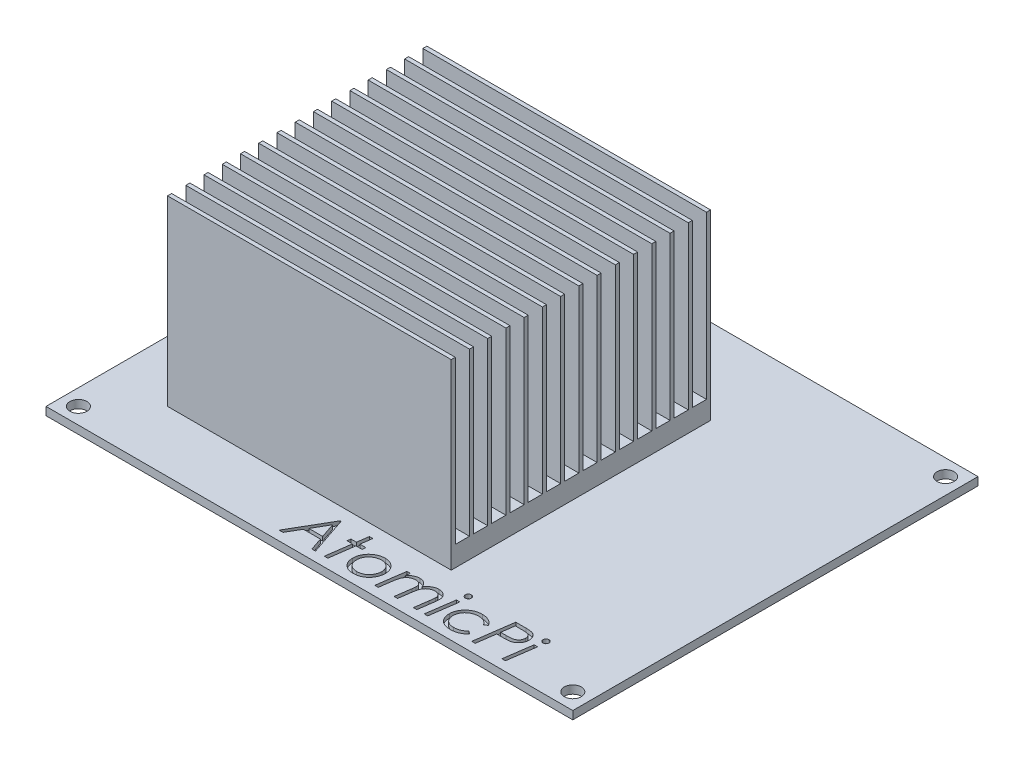
from build123d import *

# Parameters (mm, degrees)
SKETCH1_W           = 130
SKETCH1_H           = 100
SKETCH1_R           = 2.1
BOSS_EXTRUDE1_DEPTH = 2
SKETCH2_W           = 70
SKETCH2_H           = 64
BOSS_EXTRUDE2_DEPTH = 45
SKETCH3_W           = 5.891380054
SKETCH3_H           = 31.327568571
BOSS_EXTRUDE3_DEPTH = 10
CUT_EXTRUDE1_DEPTH  = 46
SKETCH5_W           = 70
SKETCH5_H           = 3.5
CUT_EXTRUDE2_DEPTH  = 40
SKETCH6_W           = 15
SKETCH6_H           = 6
BOSS_EXTRUDE4_DEPTH = 12
CUT_EXTRUDE3_DEPTH  = 1


with BuildPart() as part:
    # Sketch1 → Boss-Extrude1 (new body)
    with BuildSketch(Plane(origin=(0, 0, 0), x_dir=(1, 0, 0), z_dir=(0, 1, 0))):
        Rectangle(SKETCH1_W, SKETCH1_H)
        with Locations(Location((-61, 46, 0), (0, 0, 270))):
            Circle(SKETCH1_R, mode=Mode.SUBTRACT)
        with Locations(Location((61, 46, 0), (0, 0, 270))):
            Circle(SKETCH1_R, mode=Mode.SUBTRACT)
        with Locations(Location((-61, -46, 0), (0, 0, 270))):
            Circle(SKETCH1_R, mode=Mode.SUBTRACT)
        with Locations(Location((61, -46, 0), (0, 0, 270))):
            Circle(SKETCH1_R, mode=Mode.SUBTRACT)
    extrude(amount=BOSS_EXTRUDE1_DEPTH)

    # Sketch2 → Boss-Extrude2 (add)
    with BuildSketch(Plane(origin=(0, 2, 0), x_dir=(1, 0, 0), z_dir=(0, 1, 0))):
        with Locations((-15, -3)):
            Rectangle(SKETCH2_W, SKETCH2_H)
    extrude(amount=BOSS_EXTRUDE2_DEPTH)

    # Sketch3 → Boss-Extrude3 (add)
    with BuildSketch(Plane.XZ):
        with Locations((-62.054309973, 15.663784286)):
            Rectangle(SKETCH3_W, SKETCH3_H)
    extrude(amount=BOSS_EXTRUDE3_DEPTH)

    # Sketch4 → Cut-Extrude1 (cut)
    # profile 1 of 10: a face of its own
    with BuildSketch(Plane(origin=(0, 47, 0), x_dir=(1, 0, 0), z_dir=(0, 1, 0))):
        Polygon((-4.031924776, -38.150648634), (-0.814947613, -47.675648634), (-1.709824416, -47.675648634), (-2.78405819, -44.500648634), (-6.976050377, -44.500648634), (-8.821137517, -47.675648634), (-9.790428382, -47.675648634), (-4.251350858, -38.150648634), align=None)
        Polygon((-4.325764921, -39.938494187), (-6.479956627, -43.645840941), (-3.074082228, -43.645840941), align=None, mode=Mode.SUBTRACT)
    # profile 2 of 10: a face of its own
    with BuildSketch(Plane(origin=(0, 47, 0), x_dir=(1, 0, 0), z_dir=(0, 1, 0))):
        Polygon((2.711134118, -37.906417864), (3.571665969, -37.906417864), (3.180515127, -40.715071711), (4.649715849, -40.715071711), (4.546680993, -41.569879403), (3.062215849, -41.569879403), (2.213132315, -47.675648634), (1.352600464, -47.675648634), (2.201683998, -41.569879403), (0.864138926, -41.569879403), (0.974805993, -40.715071711), (2.319983276, -40.715071711), align=None)
    # profile 3 of 10: a face of its own
    with BuildSketch(Plane(origin=(0, 47, 0), x_dir=(1, 0, 0), z_dir=(0, 1, 0))):
        with BuildLine():
            add(Edge.make_bspline(
                [(9.324445416, -40.592956326), (9.398921038, -40.593683262), (9.546909147, -40.595127733), (9.766524754, -40.618147087), (9.982115721, -40.649353205), (10.192451173, -40.69545849), (10.397724737, -40.754724608), (10.597872525, -40.828167459), (10.795467902, -40.910718981), (10.984580491, -41.011124083), (11.168640842, -41.118742319), (11.341847963, -41.239784067), (11.506938223, -41.368911054), (11.659402395, -41.510592976), (11.80100186, -41.662170722), (11.933465638, -41.823020259), (12.05540071, -41.994442411), (12.165638813, -42.175878394), (12.265413871, -42.364696115), (12.351104575, -42.561282024), (12.423115366, -42.764356249), (12.48531702, -42.972123782), (12.530828106, -43.18729052), (12.562182428, -43.408554838), (12.585078989, -43.635826067), (12.586498606, -43.789522215), (12.587215849, -43.867175076)],
                knots=[0, 0, 0, 0, 1.03627571, 2.059150084, 3.070927706, 4.06779616, 5.054149748, 6.042845231, 7.034549244, 8.032518082, 9.021054968, 10.001029484, 10.971760647, 11.936659593, 12.895077573, 13.857576725, 14.835388912, 15.8209076, 16.811029316, 17.806244914, 18.80327064, 19.809103321, 20.823280083, 21.861332084, 22.919467504, 24, 24, 24, 24], degree=3))
            add(Edge.make_bspline(
                [(12.587215849, -43.867175076), (12.586138261, -43.956298258), (12.584001117, -44.133053271), (12.554985871, -44.395425221), (12.514020239, -44.653744052), (12.45465318, -44.907485566), (12.378480717, -45.156264167), (12.283605708, -45.398996472), (12.175997376, -45.638629248), (12.047721042, -45.869622466), (11.906784593, -46.092483544), (11.755181659, -46.304502014), (11.589432511, -46.501692009), (11.414283816, -46.687239251), (11.226786075, -46.859358885), (11.027040966, -47.018432837), (10.816426134, -47.165049168), (10.593916683, -47.296430282), (10.364029478, -47.4154976), (10.123471578, -47.516061442), (9.876790271, -47.604454138), (9.621464868, -47.67452447), (9.359801228, -47.73088949), (9.089240631, -47.767356938), (8.811712903, -47.794131671), (8.623620997, -47.796546494), (8.528787363, -47.797764018)],
                knots=[0, 0, 0, 0, 1.017087327, 2.017155118, 3.010450244, 4.002177923, 4.98990937, 5.978441356, 6.976106943, 7.986874878, 8.992202068, 9.985815693, 10.9602433, 11.931092427, 12.89734067, 13.863616201, 14.844651087, 15.824798608, 16.812129542, 17.798097515, 18.799509077, 19.80202592, 20.818957686, 21.853141412, 22.917580209, 24, 24, 24, 24], degree=3))
            add(Edge.make_bspline(
                [(8.528787363, -47.797764018), (8.412238807, -47.795678225), (8.183991345, -47.791593429), (7.850175703, -47.745433797), (7.532162184, -47.675304502), (7.228273438, -47.578658333), (6.941846736, -47.449740054), (6.670382967, -47.294419878), (6.415580977, -47.109843205), (6.178040585, -46.89927216), (5.964325269, -46.665704713), (5.774763208, -46.41628113), (5.616181188, -46.149724938), (5.485654395, -45.867758187), (5.384399373, -45.570313628), (5.311517271, -45.257902651), (5.269696438, -44.9298225), (5.263467304, -44.706199453), (5.260292772, -44.592235172)],
                knots=[0, 0, 0, 0, 1.089556378, 2.133775721, 3.145629624, 4.13340939, 5.110814317, 6.078263757, 7.054146471, 8.048729294, 9.042457604, 10.011040595, 10.974236523, 11.937854973, 12.912449201, 13.908223557, 14.933974817, 16, 16, 16, 16], degree=3))
            add(Edge.make_bspline(
                [(5.260292772, -44.592235172), (5.261369381, -44.501841108), (5.263504766, -44.322550299), (5.292539726, -44.056367418), (5.333326374, -43.794854283), (5.392641003, -43.538494332), (5.469813343, -43.288467989), (5.560379468, -43.042659855), (5.673023924, -42.804347094), (5.797342896, -42.570158644), (5.938728143, -42.345403603), (6.093103674, -42.132015431), (6.259283229, -41.930447996), (6.439821038, -41.743065353), (6.632098676, -41.567491431), (6.837440594, -41.405313123), (7.053113836, -41.253395192), (7.282151783, -41.117096145), (7.518885756, -40.993581774), (7.762133195, -40.885817652), (8.01062855, -40.796971856), (8.263127717, -40.72127856), (8.521619286, -40.664769594), (8.784613399, -40.622487455), (9.052988935, -40.596858853), (9.23343962, -40.594264648), (9.324445416, -40.592956326)],
                knots=[0, 0, 0, 0, 1.024713341, 2.032452976, 3.033353726, 4.025482262, 5.013511511, 5.999616649, 6.993631463, 8.000544617, 9.005259126, 10.002305436, 10.98592741, 11.965467619, 12.950965753, 13.936701455, 14.931265759, 15.94073365, 16.957033976, 17.958246597, 18.955397277, 19.948259791, 20.945827841, 21.953851424, 22.96807607, 24, 24, 24, 24], degree=3))
        make_face()
        with BuildLine():
            add(Edge.make_bspline(
                [(9.299640728, -41.447764018), (9.158097314, -41.452299801), (8.877359796, -41.461296081), (8.463665935, -41.540622307), (8.063593607, -41.669688073), (7.744408786, -41.817315533), (7.499543632, -41.956503188), (7.327193668, -42.072529322), (7.164615885, -42.197381069), (7.015042244, -42.333518769), (6.872635943, -42.475514645), (6.74418785, -42.63020699), (6.626477531, -42.793569289), (6.484035303, -43.022429751), (6.335997785, -43.325452534), (6.207272018, -43.710088262), (6.128473486, -44.113918106), (6.119596461, -44.389628733), (6.115100464, -44.529269427)],
                knots=[0, 0, 0, 0, 1.372743697, 2.722702845, 4.071645436, 5.444389132, 6.127359067, 6.803628796, 7.459271053, 8.114942369, 8.765332867, 9.409483052, 10.063932782, 10.718266051, 12.024090525, 13.326115932, 14.645743067, 16, 16, 16, 16], degree=3))
            add(Edge.make_bspline(
                [(6.115100464, -44.529269427), (6.117403634, -44.616497867), (6.121925444, -44.787753363), (6.154356274, -45.038411358), (6.209838994, -45.276061701), (6.286663989, -45.501022875), (6.3842089, -45.714420149), (6.504740421, -45.915687833), (6.648978224, -46.103065322), (6.812633481, -46.276355408), (6.994025948, -46.432342335), (7.188193295, -46.570288668), (7.396730429, -46.686323149), (7.61882725, -46.778471136), (7.851906887, -46.854535771), (8.099091406, -46.904471863), (8.358000128, -46.938812203), (8.535665036, -46.941558458), (8.62609806, -46.942956326)],
                knots=[0, 0, 0, 0, 1.069610863, 2.09996579, 3.093251973, 4.057699662, 5.010501648, 5.965599547, 6.928152941, 7.9047617, 8.883610534, 9.857443192, 10.821102044, 11.803301409, 12.802328473, 13.822685622, 14.891727543, 16, 16, 16, 16], degree=3))
            add(Edge.make_bspline(
                [(8.62609806, -46.942956326), (8.767600601, -46.938199441), (9.045524241, -46.928856494), (9.451812023, -46.854848046), (9.836774529, -46.731344738), (10.200495702, -46.562358783), (10.534956193, -46.344275572), (10.8361542, -46.081646127), (11.101028352, -45.7761906), (11.324461829, -45.431157514), (11.504885606, -45.058636639), (11.638299877, -44.668273096), (11.716287508, -44.262690221), (11.727004159, -43.988344602), (11.732408156, -43.8500026)],
                knots=[0, 0, 0, 0, 1.041031538, 2.044679016, 3.027709902, 4.009904446, 4.987626416, 5.956465705, 6.942045831, 7.953523378, 8.973157787, 9.981293248, 10.982043401, 12, 12, 12, 12], degree=3))
            add(Edge.make_bspline(
                [(11.732408156, -43.8500026), (11.729141413, -43.735234971), (11.722761188, -43.511084143), (11.661166993, -43.185430704), (11.564462084, -42.879698152), (11.4282844, -42.595800838), (11.256521809, -42.33718517), (11.050215292, -42.108481694), (10.812775626, -41.908590233), (10.543497311, -41.745682836), (10.255087132, -41.610574779), (9.947749201, -41.517980859), (9.628238652, -41.458297464), (9.409940481, -41.451299757), (9.299640728, -41.447764018)],
                knots=[0, 0, 0, 0, 1.077193536, 2.103849527, 3.101581798, 4.082405951, 5.051880133, 6.008097985, 6.966702469, 7.956675201, 8.956587919, 9.95073534, 10.96456583, 12, 12, 12, 12], degree=3))
        make_face(mode=Mode.SUBTRACT)
    # profile 4 of 10: a face of its own
    with BuildSketch(Plane(origin=(0, 47, 0), x_dir=(1, 0, 0), z_dir=(0, 1, 0))):
        with BuildLine():
            Line((14.796741089, -40.715071711), (15.65727294, -40.715071711))
            Line((15.65727294, -40.715071711), (15.500812603, -41.812202119))
            add(Edge.make_bspline(
                [(15.500812603, -41.812202119), (15.57170186, -41.720540523), (15.712855577, -41.538025209), (15.964525876, -41.299874224), (16.241137355, -41.088678977), (16.544773388, -40.915046186), (16.860318354, -40.77101141), (17.182818476, -40.670169643), (17.506144128, -40.605514418), (17.722764246, -40.597128701), (17.830545176, -40.592956326)],
                knots=[0, 0, 0, 0, 1.019636175, 2.030285597, 3.042363369, 4.07945189, 5.105351849, 6.092548697, 7.050933606, 8, 8, 8, 8], degree=3))
            add(Edge.make_bspline(
                [(17.830545176, -40.592956326), (17.896736466, -40.594579065), (18.026909819, -40.597770381), (18.219909172, -40.618435086), (18.406031065, -40.657026877), (18.586847312, -40.709477814), (18.763135823, -40.772557713), (18.931137009, -40.857326506), (19.096305108, -40.950675756), (19.198695424, -41.026267797), (19.250136522, -41.064245388)],
                knots=[0, 0, 0, 0, 1.042797149, 2.050789467, 3.052938591, 4.032852668, 5.015580024, 5.996927324, 6.993652328, 8, 8, 8, 8], degree=3))
            add(Edge.make_bspline(
                [(19.250136522, -41.064245388), (19.327144088, -41.130412845), (19.484152144, -41.265319377), (19.67703744, -41.522722844), (19.840560357, -41.822454261), (19.91913611, -42.044291244), (19.959932195, -42.159467744)],
                knots=[0, 0, 0, 0, 0.917554046, 1.870769106, 2.894515426, 4, 4, 4, 4], degree=3))
            add(Edge.make_bspline(
                [(19.959932195, -42.159467744), (20.041629476, -42.039563431), (20.202511541, -41.803442313), (20.489884778, -41.493157985), (20.801148289, -41.221121209), (21.140233586, -40.998497655), (21.492651342, -40.818581681), (21.852996172, -40.68997675), (22.215881187, -40.606526129), (22.460318212, -40.597456345), (22.581596858, -40.592956326)],
                knots=[0, 0, 0, 0, 1.093285388, 2.152948156, 3.180331568, 4.205067139, 5.205058416, 6.158203104, 7.086183305, 8, 8, 8, 8], degree=3))
            add(Edge.make_bspline(
                [(22.581596858, -40.592956326), (22.661837615, -40.594644129), (22.819032289, -40.5979506), (23.048621517, -40.628100398), (23.268333775, -40.67242199), (23.476064948, -40.740337107), (23.674110558, -40.823876428), (23.860240061, -40.92757162), (24.034913454, -41.050985982), (24.198130821, -41.191269468), (24.34609359, -41.346391703), (24.475163508, -41.514010736), (24.584987014, -41.691958897), (24.672733675, -41.882578295), (24.741803231, -42.083978039), (24.790877946, -42.296885665), (24.822643316, -42.520405354), (24.825780368, -42.673259839), (24.827375103, -42.750964138)],
                knots=[0, 0, 0, 0, 1.101204936, 2.15730208, 3.174669571, 4.17441865, 5.152536678, 6.122040208, 7.093586785, 8.084370698, 9.072688436, 10.031633152, 10.984194408, 11.937515935, 12.90686213, 13.902445171, 14.933698088, 16, 16, 16, 16], degree=3))
            add(Edge.make_bspline(
                [(24.827375103, -42.750964138), (24.826129638, -42.827312375), (24.823480352, -42.989716149), (24.805053559, -43.246174422), (24.776334577, -43.52995099), (24.749745183, -43.727322772), (24.735788565, -43.830922071)],
                knots=[0, 0, 0, 0, 0.84467635, 1.796749117, 2.843526446, 4, 4, 4, 4], degree=3))
            Line((24.735788565, -43.830922071), (24.193901546, -47.675648634))
            Line((24.193901546, -47.675648634), (23.333369695, -47.675648634))
            Line((23.333369695, -47.675648634), (23.80656681, -44.313659451))
            add(Edge.make_bspline(
                [(23.80656681, -44.313659451), (23.818144325, -44.229086132), (23.840507075, -44.065727072), (23.870690851, -43.829716835), (23.898187978, -43.611720978), (23.91924095, -43.411976044), (23.934286159, -43.230605669), (23.945635954, -43.068414474), (23.954534904, -42.924694942), (23.955120852, -42.834929836), (23.955394935, -42.792941302)],
                knots=[0, 0, 0, 0, 1.339891782, 2.588091189, 3.734744212, 4.788733551, 5.740509554, 6.591206585, 7.341022663, 8, 8, 8, 8], degree=3))
            add(Edge.make_bspline(
                [(23.955394935, -42.792941302), (23.954504628, -42.745169888), (23.952763859, -42.651765007), (23.932944436, -42.514937846), (23.900802262, -42.384326882), (23.854162443, -42.26012094), (23.797628103, -42.140974243), (23.725756221, -42.029424315), (23.641843694, -41.924728118), (23.545944337, -41.826903701), (23.440010618, -41.738874931), (23.326736079, -41.65796207), (23.202279104, -41.595009782), (23.071241952, -41.540108882), (22.932234518, -41.49921895), (22.785091517, -41.467452199), (22.629671357, -41.451168329), (22.523114427, -41.448910291), (22.469021738, -41.447764018)],
                knots=[0, 0, 0, 0, 1.018645287, 1.991702465, 2.942937727, 3.883267986, 4.81799953, 5.751646756, 6.707517506, 7.676781814, 8.668957119, 9.643999648, 10.639510629, 11.63751605, 12.672216696, 13.726227895, 14.845739561, 16, 16, 16, 16], degree=3))
            add(Edge.make_bspline(
                [(22.469021738, -41.447764018), (22.35288856, -41.453215087), (22.121926088, -41.464056022), (21.781566966, -41.541925764), (21.456382985, -41.677026494), (21.149147604, -41.856736494), (20.870699494, -42.071528171), (20.629623541, -42.308326723), (20.432887363, -42.565677295), (20.280074781, -42.847502908), (20.159339583, -43.159554391), (20.058306082, -43.507339959), (19.970072905, -43.896013764), (19.927081573, -44.170245942), (19.904598661, -44.313659451)],
                knots=[0, 0, 0, 0, 0.984220582, 1.957390834, 2.941640954, 3.958892467, 4.966178147, 5.915531302, 6.815990842, 7.701589139, 8.623741923, 9.647346779, 10.769647475, 12, 12, 12, 12], degree=3))
            Line((19.904598661, -44.313659451), (19.431401546, -47.675648634))
            Line((19.431401546, -47.675648634), (18.570869695, -47.675648634))
            Line((18.570869695, -47.675648634), (19.112756714, -43.830922071))
            add(Edge.make_bspline(
                [(19.112756714, -43.830922071), (19.126027443, -43.733679449), (19.151056676, -43.550275184), (19.17819454, -43.289419714), (19.194167123, -43.058995426), (19.197207753, -42.915076404), (19.198619094, -42.848274836)],
                knots=[0, 0, 0, 0, 1.19306778, 2.250183244, 3.187803657, 4, 4, 4, 4], degree=3))
            add(Edge.make_bspline(
                [(19.198619094, -42.848274836), (19.197661083, -42.79670512), (19.19577363, -42.695103528), (19.176744701, -42.546709277), (19.143598839, -42.406477308), (19.10073387, -42.274075959), (19.042047035, -42.150371648), (18.971990152, -42.034437302), (18.888953213, -41.92612909), (18.79356797, -41.827710779), (18.688885216, -41.738146667), (18.576248909, -41.659249982), (18.454377726, -41.593846033), (18.32493111, -41.541106498), (18.187787206, -41.498438527), (18.043468178, -41.468142376), (17.890754118, -41.450885436), (17.786704256, -41.448823578), (17.733234478, -41.447764018)],
                knots=[0, 0, 0, 0, 1.083420073, 2.134531926, 3.136387365, 4.108556949, 5.053325455, 6.006940478, 6.950668334, 7.914903213, 8.881913406, 9.84224937, 10.799137413, 11.782089919, 12.77561843, 13.813731979, 14.876507245, 16, 16, 16, 16], degree=3))
            add(Edge.make_bspline(
                [(17.733234478, -41.447764018), (17.642731206, -41.450707868), (17.461841063, -41.456591781), (17.194133937, -41.503923789), (16.931820818, -41.58095936), (16.679414463, -41.687733293), (16.439196323, -41.815659406), (16.221495227, -41.967592338), (16.023993124, -42.135975165), (15.851314298, -42.327101578), (15.699579196, -42.538300791), (15.568917738, -42.77297914), (15.456535608, -43.029676706), (15.368556219, -43.305927831), (15.294693349, -43.586343629), (15.229126811, -43.859681485), (15.177542948, -44.122781129), (15.149901405, -44.294499619), (15.136374502, -44.378533249)],
                knots=[0, 0, 0, 0, 1.001330282, 2.00137268, 2.99943047, 4.021922094, 5.029962193, 6.006456129, 6.954907924, 7.896883244, 8.850364991, 9.827569325, 10.86483684, 11.946870634, 13.033042326, 14.074744565, 15.057840524, 16, 16, 16, 16], degree=3))
            Line((15.136374502, -44.378533249), (14.668901546, -47.675648634))
            Line((14.668901546, -47.675648634), (13.808369695, -47.675648634))
            Line((13.808369695, -47.675648634), (14.796741089, -40.715071711))
        make_face()
    # profile 5 of 10: a face of its own
    with BuildSketch(Plane(origin=(0, 47, 0), x_dir=(1, 0, 0), z_dir=(0, 1, 0))):
        with BuildLine():
            add(Edge.make_bspline(
                [(27.729523541, -37.78430248), (27.778123638, -37.786814776), (27.873871236, -37.791764278), (28.012362285, -37.832908869), (28.137729079, -37.903761099), (28.249837603, -37.996680726), (28.342757229, -38.108789249), (28.41360946, -38.234156043), (28.45475405, -38.372647092), (28.459703553, -38.468394691), (28.462215849, -38.516994787)],
                knots=[0, 0, 0, 0, 1.013030613, 1.995783029, 2.982024995, 4, 5.017975005, 6.004216971, 6.986969387, 8, 8, 8, 8], degree=3))
            add(Edge.make_bspline(
                [(28.462215849, -38.516994787), (28.459681467, -38.56621837), (28.454688669, -38.663190099), (28.414039848, -38.803131946), (28.342762693, -38.929087492), (28.249677188, -39.040811718), (28.138818829, -39.13481387), (28.011218597, -39.200217821), (27.874016639, -39.242494798), (27.778172593, -39.247265537), (27.729523541, -39.249687095)],
                knots=[0, 0, 0, 0, 1.024536501, 2.018363392, 3.002960043, 4.019236793, 5.035513544, 6.007546471, 6.988659393, 8, 8, 8, 8], degree=3))
            add(Edge.make_bspline(
                [(27.729523541, -39.249687095), (27.68025007, -39.247245151), (27.583180058, -39.242434457), (27.444538679, -39.20063094), (27.316343309, -39.134817013), (27.20586645, -39.040651879), (27.111701315, -38.930175019), (27.045887388, -38.80197965), (27.004083871, -38.663338271), (26.999273178, -38.566268259), (26.996831233, -38.516994787)],
                knots=[0, 0, 0, 0, 1.022830147, 2.01500183, 2.985415847, 4, 5.014584153, 5.98499817, 6.977169853, 8, 8, 8, 8], degree=3))
            add(Edge.make_bspline(
                [(26.996831233, -38.516994787), (26.999252791, -38.468345735), (27.00402353, -38.37250169), (27.046300507, -38.235299731), (27.111704458, -38.107699499), (27.205706611, -37.99684114), (27.317430836, -37.903755635), (27.443386382, -37.83247848), (27.58332823, -37.791829659), (27.680299959, -37.786836862), (27.729523541, -37.78430248)],
                knots=[0, 0, 0, 0, 1.011340607, 1.992453529, 2.964486456, 3.980763207, 4.997039957, 5.981636608, 6.975463499, 8, 8, 8, 8], degree=3))
        make_face()
    # profile 6 of 10: a face of its own
    with BuildSketch(Plane(origin=(0, 47, 0), x_dir=(1, 0, 0), z_dir=(0, 1, 0))):
        Polygon((27.008279551, -40.715071711), (27.868811401, -40.715071711), (26.880440007, -47.675648634), (26.019908156, -47.675648634), align=None)
    # profile 7 of 10: a face of its own
    with BuildSketch(Plane(origin=(0, 47, 0), x_dir=(1, 0, 0), z_dir=(0, 1, 0))):
        with BuildLine():
            Line((36.399715849, -42.237697912), (35.659391329, -42.668917864))
            add(Edge.make_bspline(
                [(35.659391329, -42.668917864), (35.592602078, -42.571539175), (35.461348566, -42.380171631), (35.223248578, -42.130466066), (34.960388805, -41.919433764), (34.67235348, -41.744512934), (34.357078667, -41.611362589), (34.016053271, -41.51604397), (33.649652792, -41.457955838), (33.396658945, -41.451222839), (33.266693012, -41.447764018)],
                knots=[0, 0, 0, 0, 1.006368034, 1.977703555, 2.931287349, 3.876057278, 4.843853284, 5.842109818, 6.891466274, 8, 8, 8, 8], degree=3))
            add(Edge.make_bspline(
                [(33.266693012, -41.447764018), (33.114390859, -41.452431135), (32.814276381, -41.461627782), (32.374306747, -41.537472679), (31.95590815, -41.664648479), (31.624838203, -41.809032314), (31.375963299, -41.948616125), (31.199662998, -42.063732235), (31.033282324, -42.187956964), (30.876702368, -42.321338276), (30.730441816, -42.464729804), (30.597964706, -42.620153439), (30.472362403, -42.782919174), (30.32191596, -43.011760135), (30.16508631, -43.31266845), (30.028245449, -43.690352118), (29.942264401, -44.080829882), (29.932503769, -44.346299828), (29.927600464, -44.479660052)],
                knots=[0, 0, 0, 0, 1.454102064, 2.865337582, 4.249080667, 5.622785341, 6.305501153, 6.972770453, 7.632530544, 8.287518448, 8.936193138, 9.586572476, 10.23663963, 10.898828654, 12.200395727, 13.46683786, 14.727452674, 16, 16, 16, 16], degree=3))
            add(Edge.make_bspline(
                [(29.927600464, -44.479660052), (29.930711162, -44.596359249), (29.936808004, -44.825084931), (30.00120918, -45.158112246), (30.099360317, -45.473628764), (30.238936394, -45.767695541), (30.414478413, -46.035805985), (30.62380035, -46.272647996), (30.866590241, -46.475825631), (31.140010888, -46.645736814), (31.443279962, -46.779470617), (31.773052713, -46.874673352), (32.128703949, -46.93290173), (32.374766833, -46.939537099), (32.501563805, -46.942956326)],
                knots=[0, 0, 0, 0, 1.045843838, 2.049811393, 3.031591347, 4.004123559, 4.960090976, 5.89793496, 6.829507999, 7.790673054, 8.776821496, 9.793488215, 10.862977582, 12, 12, 12, 12], degree=3))
            add(Edge.make_bspline(
                [(32.501563805, -46.942956326), (32.634056835, -46.939318343), (32.897111573, -46.932095408), (33.287307668, -46.87309627), (33.667294349, -46.775433374), (34.033023683, -46.642314938), (34.374860694, -46.481977806), (34.680767642, -46.293174909), (34.950087313, -46.085582304), (35.098596923, -45.92307058), (35.170929791, -45.843917864)],
                knots=[0, 0, 0, 0, 1.070010768, 2.124424235, 3.180001424, 4.234915574, 5.26459992, 6.22431616, 7.135138096, 8, 8, 8, 8], degree=3))
            Line((35.170929791, -45.843917864), (35.91125431, -46.364816302))
            add(Edge.make_bspline(
                [(35.91125431, -46.364816302), (35.796427287, -46.482880964), (35.572183459, -46.713447524), (35.205319094, -47.013719487), (34.821419982, -47.260438136), (34.422201258, -47.463123922), (33.997741699, -47.615259236), (33.544393403, -47.720490527), (33.059423793, -47.787197279), (32.725033054, -47.794175598), (32.553081233, -47.797764018)],
                knots=[0, 0, 0, 0, 1.047829676, 2.046289557, 3.009860242, 3.947775691, 4.890372095, 5.872402488, 6.905937807, 8, 8, 8, 8], degree=3))
            add(Edge.make_bspline(
                [(32.553081233, -47.797764018), (32.420023388, -47.795557892), (32.160838462, -47.791260554), (31.783279164, -47.747507446), (31.427738465, -47.681013695), (31.095234416, -47.582465804), (30.784815836, -47.459002356), (30.496126712, -47.307201094), (30.229416047, -47.128080759), (29.989187893, -46.918650787), (29.773801042, -46.688347257), (29.585175563, -46.438641477), (29.425422971, -46.170308094), (29.297968556, -45.881333685), (29.196538742, -45.575382787), (29.123707641, -45.250828283), (29.082180205, -44.908145596), (29.075965891, -44.673756557), (29.072792772, -44.554074114)],
                knots=[0, 0, 0, 0, 1.185921745, 2.310070768, 3.3844686, 4.407310063, 5.39721934, 6.358648368, 7.310259435, 8.255087002, 9.193990185, 10.117245901, 11.04024032, 11.971905126, 12.927765079, 13.910107976, 14.932870829, 16, 16, 16, 16], degree=3))
            add(Edge.make_bspline(
                [(29.072792772, -44.554074114), (29.076304303, -44.419661456), (29.083210646, -44.155303857), (29.142538236, -43.766519682), (29.237957641, -43.392458207), (29.371294749, -43.03243588), (29.545682904, -42.688986733), (29.753852175, -42.358352967), (30.004121492, -42.045007682), (30.288719531, -41.749709811), (30.599690755, -41.479267589), (30.932719611, -41.242277753), (31.282381617, -41.041941546), (31.649053916, -40.875325921), (32.03438468, -40.751113366), (32.435527865, -40.657760182), (32.854404556, -40.604697849), (33.139347042, -40.596907481), (33.283865488, -40.592956326)],
                knots=[0, 0, 0, 0, 1.002277488, 1.971240463, 2.926408626, 3.878259464, 4.828891444, 5.795073931, 6.788042611, 7.81489549, 8.85089398, 9.85806746, 10.85914251, 11.853029005, 12.856832748, 13.874314015, 14.921884765, 16, 16, 16, 16], degree=3))
            add(Edge.make_bspline(
                [(33.283865488, -40.592956326), (33.371025252, -40.594743272), (33.543002662, -40.598269147), (33.797371354, -40.616595259), (34.043825738, -40.651470102), (34.282803328, -40.698970441), (34.513584551, -40.759823241), (34.736934442, -40.834456936), (34.951157967, -40.924404558), (35.158383458, -41.024993332), (35.353893858, -41.139895221), (35.540141031, -41.26369364), (35.713428093, -41.399124544), (35.875686464, -41.545524762), (36.02481464, -41.703060869), (36.163918581, -41.86968889), (36.288370323, -42.048578483), (36.362353334, -42.174238), (36.399715849, -42.237697912)],
                knots=[0, 0, 0, 0, 1.130497713, 2.230617195, 3.3049554, 4.356410595, 5.388766123, 6.39819681, 7.407661195, 8.399962059, 9.383171059, 10.346280706, 11.298306692, 12.232660293, 13.177800963, 14.109273957, 15.04515541, 16, 16, 16, 16], degree=3))
        make_face()
    # profile 8 of 10: a face of its own
    with BuildSketch(Plane(origin=(0, 47, 0), x_dir=(1, 0, 0), z_dir=(0, 1, 0))):
        with BuildLine():
            Line((39.078622099, -38.150648634), (41.595343853, -38.150648634))
            add(Edge.make_bspline(
                [(41.595343853, -38.150648634), (41.695848511, -38.151275749), (41.889295506, -38.152482793), (42.167943563, -38.164555673), (42.425062884, -38.181200666), (42.660281167, -38.204405823), (42.873314055, -38.239684742), (43.06379017, -38.279181625), (43.23368128, -38.323495417), (43.427462285, -38.397322163), (43.645829944, -38.510517926), (43.880659545, -38.68045552), (44.084759571, -38.889344113), (44.262988417, -39.127368876), (44.40600172, -39.396106143), (44.507549858, -39.690968057), (44.569843134, -40.008391735), (44.577510223, -40.228226839), (44.581446618, -40.341093345)],
                knots=[0, 0, 0, 0, 1.135332684, 2.185238988, 3.150208107, 4.046040219, 4.854001743, 5.588181339, 6.243560949, 6.834748932, 7.927376448, 9.012417828, 10.094600696, 11.214043572, 12.361542901, 13.518161337, 14.725788303, 16, 16, 16, 16], degree=3))
            add(Edge.make_bspline(
                [(44.581446618, -40.341093345), (44.580187612, -40.416215153), (44.577715693, -40.563708567), (44.551994489, -40.781345716), (44.510034984, -40.991144415), (44.452589608, -41.194007703), (44.380254418, -41.390680342), (44.288509501, -41.578633844), (44.180256523, -41.759155676), (44.059487024, -41.932224633), (43.923919608, -42.092909401), (43.780717488, -42.243004618), (43.627526676, -42.378897683), (43.465143939, -42.500935887), (43.294807367, -42.609908684), (43.1168775, -42.706434573), (42.928512145, -42.786517501), (42.798366858, -42.830065634), (42.732543373, -42.852090941)],
                knots=[0, 0, 0, 0, 1.077613652, 2.115775993, 3.139637116, 4.14510796, 5.138576732, 6.142762576, 7.14141659, 8.156821813, 9.16766358, 10.155287502, 11.131543445, 12.102666116, 13.067290607, 14.031007908, 15.004144336, 16, 16, 16, 16], degree=3))
            add(Edge.make_bspline(
                [(42.732543373, -42.852090941), (42.679256616, -42.866635315), (42.564590768, -42.897932827), (42.377402367, -42.935869788), (42.162422733, -42.964587184), (41.920218689, -42.992566536), (41.648886094, -43.009400768), (41.350026353, -43.02610051), (41.023583203, -43.032086544), (40.797140295, -43.034177525), (40.679478469, -43.035264018)],
                knots=[0, 0, 0, 0, 0.641206386, 1.379788876, 2.215232503, 3.158725674, 4.209900022, 5.370746801, 6.633815758, 8, 8, 8, 8], degree=3))
            Line((40.679478469, -43.035264018), (39.254162964, -43.035264018))
            Line((39.254162964, -43.035264018), (38.60351693, -47.675648634))
            Line((38.60351693, -47.675648634), (37.742985079, -47.675648634))
            Line((37.742985079, -47.675648634), (39.078622099, -38.150648634))
        make_face()
        with BuildLine():
            Line((39.818946618, -39.005456326), (39.374370296, -42.180456326))
            Line((39.374370296, -42.180456326), (40.710007315, -42.180456326))
            add(Edge.make_bspline(
                [(40.710007315, -42.180456326), (40.81812918, -42.179376465), (41.025494499, -42.177305414), (41.323963272, -42.171272562), (41.596124667, -42.154700883), (41.842629521, -42.137502811), (42.062859892, -42.110625351), (42.256862299, -42.078112457), (42.426498294, -42.04366588), (42.614819449, -41.985548668), (42.824037049, -41.893844526), (43.047596545, -41.748860805), (43.24650472, -41.571760207), (43.41550832, -41.362791252), (43.55431993, -41.132629146), (43.654919565, -40.884943232), (43.716388295, -40.624578761), (43.723199006, -40.446367707), (43.726638926, -40.356357768)],
                knots=[0, 0, 0, 0, 1.292499712, 2.478866002, 3.567711026, 4.55136461, 5.4320969, 6.218239379, 6.902667729, 7.499057556, 8.571240445, 9.621392161, 10.671323708, 11.74113212, 12.821985709, 13.872330035, 14.925367204, 16, 16, 16, 16], degree=3))
            add(Edge.make_bspline(
                [(43.726638926, -40.356357768), (43.724261376, -40.283028235), (43.719674121, -40.141545857), (43.678999633, -39.937279814), (43.609642193, -39.751089298), (43.516254324, -39.58205078), (43.398993448, -39.433667998), (43.259645065, -39.307963887), (43.099337388, -39.205662981), (42.947462245, -39.141552585), (42.809233091, -39.101983392), (42.685029677, -39.075149736), (42.540686848, -39.055872512), (42.377416393, -39.035502801), (42.193886522, -39.024220178), (41.991109996, -39.011257113), (41.768359066, -39.00668857), (41.613151069, -39.005878106), (41.532378108, -39.005456326)],
                knots=[0, 0, 0, 0, 1.185493767, 2.287297747, 3.351910597, 4.388303413, 5.399095946, 6.397186861, 7.410490164, 8.461641879, 9.051030142, 9.735191633, 10.515167525, 11.40603511, 12.396458938, 13.488902119, 14.693180664, 16, 16, 16, 16], degree=3))
            Line((41.532378108, -39.005456326), (39.818946618, -39.005456326))
        make_face(mode=Mode.SUBTRACT)
    # profile 9 of 10: a face of its own
    with BuildSketch(Plane(origin=(0, 47, 0), x_dir=(1, 0, 0), z_dir=(0, 1, 0))):
        with BuildLine():
            add(Edge.make_bspline(
                [(46.901638926, -37.78430248), (46.950239022, -37.786814776), (47.045986621, -37.791764278), (47.18447767, -37.832908869), (47.309844464, -37.903761099), (47.421952987, -37.996680726), (47.514872614, -38.108789249), (47.585724844, -38.234156043), (47.626869435, -38.372647092), (47.631818937, -38.468394691), (47.634331233, -38.516994787)],
                knots=[0, 0, 0, 0, 1.013030613, 1.995783029, 2.982024995, 4, 5.017975005, 6.004216971, 6.986969387, 8, 8, 8, 8], degree=3))
            add(Edge.make_bspline(
                [(47.634331233, -38.516994787), (47.631796851, -38.56621837), (47.626804054, -38.663190099), (47.586155233, -38.803131946), (47.514878078, -38.929087492), (47.421792573, -39.040811718), (47.310934214, -39.13481387), (47.183333982, -39.200217821), (47.046132023, -39.242494798), (46.950287978, -39.247265537), (46.901638926, -39.249687095)],
                knots=[0, 0, 0, 0, 1.024536501, 2.018363392, 3.002960043, 4.019236793, 5.035513544, 6.007546471, 6.988659393, 8, 8, 8, 8], degree=3))
            add(Edge.make_bspline(
                [(46.901638926, -39.249687095), (46.852365454, -39.247245151), (46.755295442, -39.242434457), (46.616654063, -39.20063094), (46.488458694, -39.134817013), (46.377981834, -39.040651879), (46.2838167, -38.930175019), (46.218002773, -38.80197965), (46.176199256, -38.663338271), (46.171388562, -38.566268259), (46.168946618, -38.516994787)],
                knots=[0, 0, 0, 0, 1.022830147, 2.01500183, 2.985415847, 4, 5.014584153, 5.98499817, 6.977169853, 8, 8, 8, 8], degree=3))
            add(Edge.make_bspline(
                [(46.168946618, -38.516994787), (46.171368176, -38.468345735), (46.176138915, -38.37250169), (46.218415892, -38.235299731), (46.283819843, -38.107699499), (46.377821995, -37.99684114), (46.489546221, -37.903755635), (46.615501767, -37.83247848), (46.755443614, -37.791829659), (46.852415343, -37.786836862), (46.901638926, -37.78430248)],
                knots=[0, 0, 0, 0, 1.011340607, 1.992453529, 2.964486456, 3.980763207, 4.997039957, 5.981636608, 6.975463499, 8, 8, 8, 8], degree=3))
        make_face()
    # profile 10 of 10: a face of its own
    with BuildSketch(Plane(origin=(0, 47, 0), x_dir=(1, 0, 0), z_dir=(0, 1, 0))):
        Polygon((46.180394935, -40.715071711), (47.040926786, -40.715071711), (46.052555392, -47.675648634), (45.192023541, -47.675648634), align=None)
    extrude(amount=-CUT_EXTRUDE1_DEPTH, mode=Mode.SUBTRACT)

    # Sketch5 → Cut-Extrude2 (cut)
    with BuildSketch(Plane(origin=(0, 47, 0), x_dir=(1, 0, 0), z_dir=(0, 1, 0))):
        with Locations((-15, 26.25)):
            Rectangle(SKETCH5_W, SKETCH5_H)
        with Locations((-15, 21.75)):
            Rectangle(SKETCH5_W, SKETCH5_H)
        with Locations((-15, 17.25)):
            Rectangle(SKETCH5_W, SKETCH5_H)
        with Locations((-15, 12.75)):
            Rectangle(SKETCH5_W, SKETCH5_H)
        with Locations((-15, 8.25)):
            Rectangle(SKETCH5_W, SKETCH5_H)
        with Locations((-15, 3.75)):
            Rectangle(SKETCH5_W, SKETCH5_H)
        with Locations((-15, -0.75)):
            Rectangle(SKETCH5_W, SKETCH5_H)
        with Locations((-15, -5.25)):
            Rectangle(SKETCH5_W, SKETCH5_H)
        with Locations((-15, -9.75)):
            Rectangle(SKETCH5_W, SKETCH5_H)
        with Locations((-15, -14.25)):
            Rectangle(SKETCH5_W, SKETCH5_H)
        with Locations((-15, -18.75)):
            Rectangle(SKETCH5_W, SKETCH5_H)
        with Locations((-15, -23.25)):
            Rectangle(SKETCH5_W, SKETCH5_H)
        with Locations((-15, -27.75)):
            Rectangle(SKETCH5_W, SKETCH5_H)
        with Locations((-15, -32.25)):
            Rectangle(SKETCH5_W, SKETCH5_H)
    extrude(amount=-CUT_EXTRUDE2_DEPTH, mode=Mode.SUBTRACT)

    # Sketch6 → Boss-Extrude4 (add)
    with BuildSketch(Plane(origin=(0, 0, -50), x_dir=(-1, 0, 0), z_dir=(0, 0, -1))):
        with Locations((47.5, 5)):
            Rectangle(SKETCH6_W, SKETCH6_H)
    extrude(amount=-BOSS_EXTRUDE4_DEPTH)

    # Sketch7 → Cut-Extrude3 (cut)
    # profile 1 of 4: a face of its own
    with BuildSketch(Plane(origin=(0, 8, 0), x_dir=(1, 0, 0), z_dir=(0, 1, 0))):
        Polygon((-53.355914008, 45.913905155), (-53.039708078, 45.913905155), (-53.240930034, 44.478007719), (-51.405393175, 44.478007719), (-51.204171219, 45.913905155), (-50.88796529, 45.913905155), (-51.378750546, 42.413905155), (-51.694956476, 42.413905155), (-51.449563848, 44.163905155), (-53.285100707, 44.163905155), (-53.530493335, 42.413905155), (-53.846699264, 42.413905155), align=None)
    # profile 2 of 4: a face of its own
    with BuildSketch(Plane(origin=(0, 8, 0), x_dir=(1, 0, 0), z_dir=(0, 1, 0))):
        with BuildLine():
            Line((-50.035401187, 45.913905155), (-49.308337886, 45.913905155))
            add(Edge.make_bspline(
                [(-49.308337886, 45.913905155), (-49.252467508, 45.91346582), (-49.14391915, 45.912612255), (-48.986277948, 45.903209849), (-48.838636431, 45.888792059), (-48.701040315, 45.868519611), (-48.573240053, 45.843181102), (-48.455766323, 45.810667303), (-48.348012358, 45.773488782), (-48.250147934, 45.728436906), (-48.159376649, 45.678028953), (-48.07333106, 45.621896908), (-47.992382681, 45.558613174), (-47.915126189, 45.489874734), (-47.844089172, 45.413361613), (-47.775345548, 45.332262751), (-47.712522144, 45.243572504), (-47.654459728, 45.149170116), (-47.60218373, 45.049790748), (-47.555390137, 44.946848746), (-47.517427479, 44.839849991), (-47.484387318, 44.730116065), (-47.460281533, 44.616309155), (-47.442831184, 44.499241512), (-47.431959273, 44.378653808), (-47.430681436, 44.297141169), (-47.430032598, 44.25575211)],
                knots=[0, 0, 0, 0, 1.407956197, 2.735462629, 3.978575056, 5.14562376, 6.239569826, 7.259868312, 8.215552976, 9.109099244, 9.971265144, 10.830589362, 11.695387039, 12.558759329, 13.433767108, 14.324435478, 15.23648578, 16.169930002, 17.115835343, 18.064962916, 19.017083207, 19.975070357, 20.951299687, 21.945924981, 22.957017783, 24, 24, 24, 24], degree=3))
            add(Edge.make_bspline(
                [(-47.430032598, 44.25575211), (-47.43090034, 44.211557449), (-47.432625179, 44.123710337), (-47.444637741, 43.993213976), (-47.465147675, 43.865416574), (-47.493060261, 43.740011958), (-47.529760727, 43.617402968), (-47.573768476, 43.497060002), (-47.626846479, 43.3797547), (-47.686604054, 43.265780871), (-47.752072461, 43.156843404), (-47.822342061, 43.05518805), (-47.895671226, 42.960706885), (-47.973930022, 42.875139411), (-48.055083533, 42.796935393), (-48.14037239, 42.7273096), (-48.229063302, 42.665229893), (-48.32250332, 42.610303596), (-48.424272825, 42.563498811), (-48.535977069, 42.522658966), (-48.659852373, 42.489843899), (-48.794618445, 42.46170611), (-48.940955984, 42.440179765), (-49.098928688, 42.425338636), (-49.268470458, 42.414978612), (-49.385444465, 42.414270346), (-49.445757758, 42.413905155)],
                knots=[0, 0, 0, 0, 1.023590641, 2.03462318, 3.032234983, 4.019795062, 5.008022507, 5.994484159, 6.985450496, 7.987853078, 8.973750197, 9.927208411, 10.848723504, 11.741556299, 12.6106407, 13.456920821, 14.288848772, 15.116061311, 15.963690692, 16.879848279, 17.867349015, 18.92897855, 20.067338715, 21.291093664, 22.603253266, 24, 24, 24, 24], degree=3))
            Line((-49.445757758, 42.413905155), (-50.526186444, 42.413905155))
            Line((-50.526186444, 42.413905155), (-50.035401187, 45.913905155))
        make_face()
        with BuildLine():
            Line((-49.763365931, 45.59980259), (-50.165809841, 42.728007719))
            Line((-50.165809841, 42.728007719), (-49.858718495, 42.728007719))
            add(Edge.make_bspline(
                [(-49.858718495, 42.728007719), (-49.802161742, 42.72822619), (-49.693954381, 42.728644182), (-49.539218959, 42.729481124), (-49.39923224, 42.733341742), (-49.274435291, 42.73753066), (-49.16427437, 42.741784539), (-49.069430932, 42.749207361), (-48.989114461, 42.756131895), (-48.940925524, 42.76332759), (-48.91921529, 42.766569417)],
                knots=[0, 0, 0, 0, 1.442493111, 2.759853895, 3.946400474, 5.013958638, 5.944757951, 6.757596782, 7.440268535, 8, 8, 8, 8], degree=3))
            add(Edge.make_bspline(
                [(-48.91921529, 42.766569417), (-48.862627737, 42.77759793), (-48.752762596, 42.799009868), (-48.596526596, 42.848894831), (-48.454885045, 42.913822184), (-48.346475388, 42.979083989), (-48.267679444, 43.040421724), (-48.210527266, 43.091012054), (-48.156053549, 43.147321052), (-48.103163286, 43.208489311), (-48.052752714, 43.27534166), (-48.004373024, 43.347349135), (-47.959159365, 43.425071204), (-47.914608604, 43.506298355), (-47.875413322, 43.592022685), (-47.839669691, 43.679944108), (-47.810757512, 43.770362202), (-47.785908824, 43.862209496), (-47.76686784, 43.956104093), (-47.753705609, 44.051884482), (-47.745891708, 44.149752468), (-47.744724301, 44.215540504), (-47.744135162, 44.248740892)],
                knots=[0, 0, 0, 0, 1.66921684, 3.240796505, 4.737423238, 6.174950648, 6.894049088, 7.627787166, 8.384256673, 9.161939998, 9.968982309, 10.808348516, 11.67339838, 12.573072656, 13.490905661, 14.402399116, 15.320906089, 16.23893884, 17.15777014, 18.094193054, 19.038221359, 20, 20, 20, 20], degree=3))
            add(Edge.make_bspline(
                [(-47.744135162, 44.248740892), (-47.744587577, 44.283586262), (-47.745478845, 44.35223247), (-47.755102506, 44.453346701), (-47.769438893, 44.551091059), (-47.790618565, 44.645506578), (-47.81798085, 44.736583226), (-47.851013226, 44.824417358), (-47.88943073, 44.90902907), (-47.93476156, 44.989402104), (-47.98383314, 45.066575562), (-48.039255899, 45.138128434), (-48.097700223, 45.205657776), (-48.161289525, 45.26746497), (-48.228775739, 45.324716878), (-48.301216676, 45.376369026), (-48.377802836, 45.423977628), (-48.431935361, 45.450891198), (-48.459279393, 45.464486084)],
                knots=[0, 0, 0, 0, 1.120622261, 2.207652496, 3.264547841, 4.296931978, 5.317338296, 6.321354955, 7.313791919, 8.303262802, 9.287578962, 10.252963919, 11.212004547, 12.158348376, 13.10268917, 14.056203162, 15.018127421, 16, 16, 16, 16], degree=3))
            add(Edge.make_bspline(
                [(-48.459279393, 45.464486084), (-48.484799877, 45.475509064), (-48.538848081, 45.498853929), (-48.628888582, 45.525171512), (-48.730343225, 45.549237142), (-48.844512196, 45.567584775), (-48.970609076, 45.582134382), (-49.109079313, 45.592403841), (-49.259667474, 45.598709976), (-49.364187261, 45.599429361), (-49.418414008, 45.59980259)],
                knots=[0, 0, 0, 0, 0.683593997, 1.447740037, 2.304372588, 3.249017606, 4.291364313, 5.427749439, 6.665470115, 8, 8, 8, 8], degree=3))
            Line((-49.418414008, 45.59980259), (-49.763365931, 45.59980259))
        make_face(mode=Mode.SUBTRACT)
    # profile 3 of 4: a face of its own
    with BuildSketch(Plane(origin=(0, 8, 0), x_dir=(1, 0, 0), z_dir=(0, 1, 0))):
        Polygon((-43.301827469, 45.913905155), (-43.301827469, 42.413905155), (-43.615930034, 42.413905155), (-43.615930034, 44.835579834), (-45.021679232, 42.413905155), (-45.105112726, 42.413905155), (-46.061442854, 44.965988488), (-46.746438848, 42.413905155), (-47.071058239, 42.413905155), (-46.128750546, 45.913905155), (-46.087384361, 45.913905155), (-45.014668014, 43.039305796), (-43.346699264, 45.913905155), align=None)
    # profile 4 of 4: a face of its own
    with BuildSketch(Plane(origin=(0, 8, 0), x_dir=(1, 0, 0), z_dir=(0, 1, 0))):
        Polygon((-42.13796529, 45.913905155), (-41.821759361, 45.913905155), (-42.312544617, 42.413905155), (-42.628750546, 42.413905155), align=None)
    extrude(amount=-CUT_EXTRUDE3_DEPTH, mode=Mode.SUBTRACT)


solid = part.part
